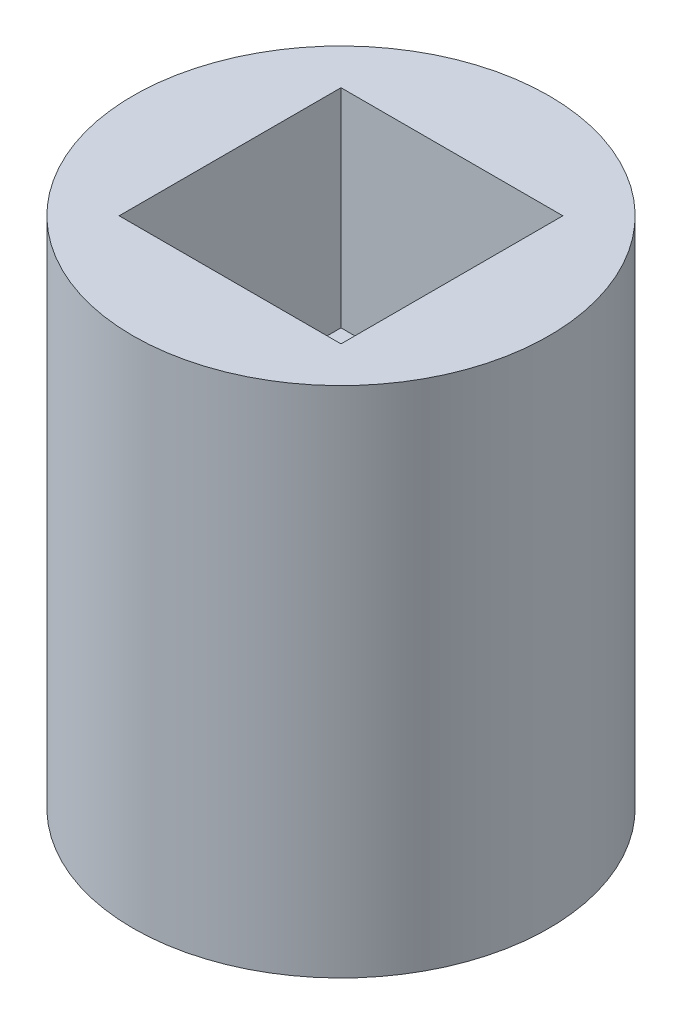
from build123d import *

# Parameters (mm, degrees)
SKETCH1_R           = 6.5
SKETCH1_R_2         = 4.08
BOSS_EXTRUDE1_DEPTH = 20
SKETCH2_R           = 15
BOSS_EXTRUDE2_DEPTH = 2
SKETCH3_R           = 15
SKETCH3_W           = 16
SKETCH3_H           = 16
BOSS_EXTRUDE3_DEPTH = 15
BOSS_EXTRUDE4_START = 20
SKETCH4_R           = 15
SKETCH4_R_2         = 6.5
BOSS_EXTRUDE4_DEPTH = 20
SKETCH6_R           = 1
CUT_EXTRUDE1_DEPTH  = 24
CUT_EXTRUDE2_START  = 10
SKETCH8_R           = 3
SKETCH8_R_2         = 1
CUT_EXTRUDE2_DEPTH  = 10
CHAMFER1_SIZE       = 2


with BuildPart() as part:
    # Sketch1 → Boss-Extrude1 (new body)
    with BuildSketch(Plane(origin=(0, 0, 0), x_dir=(1, 0, 0), z_dir=(0, 1, 0))):
        with Locations(Location((0, 0, 0), (0, 0, 270))):
            Circle(SKETCH1_R)
        with Locations(Location((0, 0, 0), (0, 0, 270))):
            Circle(SKETCH1_R_2, mode=Mode.SUBTRACT)
    extrude(amount=BOSS_EXTRUDE1_DEPTH)

    # Sketch2 → Boss-Extrude2 (add)
    with BuildSketch(Plane(origin=(0, 20, 0), x_dir=(1, 0, 0), z_dir=(0, 1, 0))):
        with Locations(Location((0, 0, 0), (0, 0, 270))):
            Circle(SKETCH2_R)
    extrude(amount=BOSS_EXTRUDE2_DEPTH)

    # Sketch3 → Boss-Extrude3 (add)
    with BuildSketch(Plane(origin=(0, 22, 0), x_dir=(1, 0, 0), z_dir=(0, 1, 0))):
        with Locations(Location((0, 0, 0), (0, 0, 270))):
            Circle(SKETCH3_R)
        Rectangle(SKETCH3_W, SKETCH3_H, mode=Mode.SUBTRACT)
    extrude(amount=BOSS_EXTRUDE3_DEPTH)

    # Sketch4 → Boss-Extrude4 (add)
    with BuildSketch(Plane.XZ.offset(-20).offset(BOSS_EXTRUDE4_START)):
        with Locations(Location((0, 0, 0), (0, 0, 90))):
            Circle(SKETCH4_R)
        Circle(SKETCH4_R_2, mode=Mode.SUBTRACT)
    extrude(amount=-BOSS_EXTRUDE4_DEPTH)

    # Sketch6 → Cut-Extrude1 (cut)
    with BuildSketch(Plane.XY):
        with Locations(Location((0, 6, 0), (0, 0, 90))):
            Circle(SKETCH6_R)
    extrude(amount=-CUT_EXTRUDE1_DEPTH, mode=Mode.SUBTRACT)

    # Sketch8 → Cut-Extrude2 (cut)
    with BuildSketch(Plane.XY.offset(-16.5).offset(CUT_EXTRUDE2_START)):
        with Locations(Location((0, 6, 0), (0, 0, 90))):
            Circle(SKETCH8_R)
        with Locations((0, 6)):
            Circle(SKETCH8_R_2, mode=Mode.SUBTRACT)
    extrude(amount=-CUT_EXTRUDE2_DEPTH, mode=Mode.SUBTRACT)

    # Chamfer1
    chamfer1_edges = [part.edges().sort_by_distance(p)[0] for p in [
        (0, 0, -4.08),
    ]]
    chamfer(chamfer1_edges, length=CHAMFER1_SIZE)


solid = part.part
